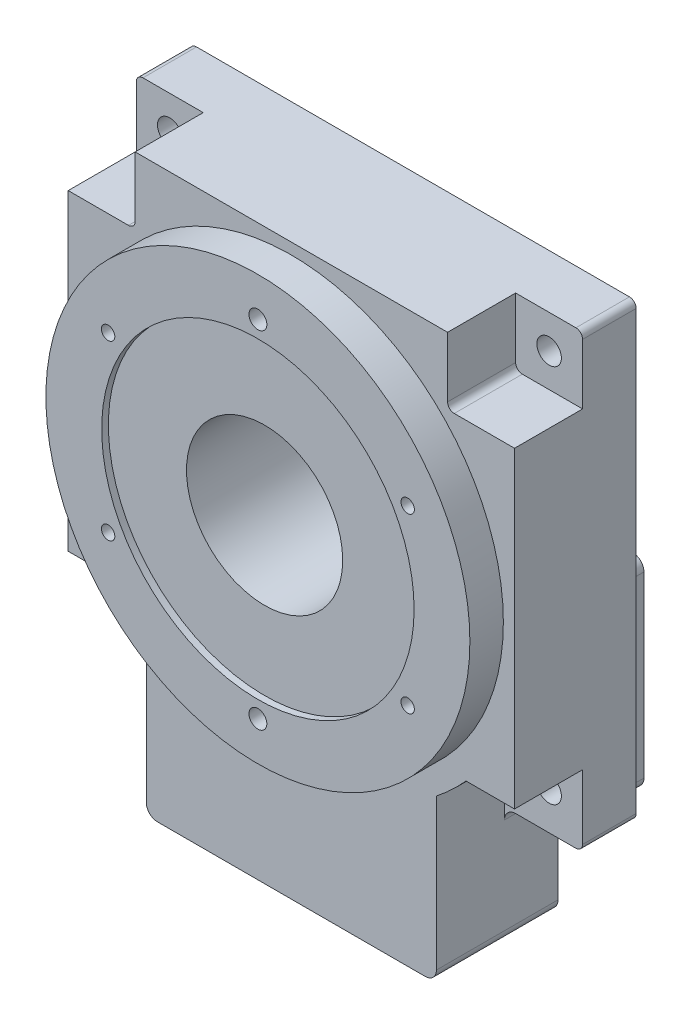
from build123d import *

# Parameters (mm, degrees)
SKETCH_1_R          = 4
SKETCH_1_R_2        = 5.5
SKETCH_1_R_3        = 35
EXTRUDE_1_DEPTH     = 54.5
SKETCH_1_R_4        = 3
EXTRUDE_1_2_DEPTH   = 54.5
EXTRUDE_1_3_DEPTH   = 54.5
SKETCH_1_3_R        = 5.5
EXTRUDE_2_DEPTH     = 24
EXTRUDE_START       = 54.5
SKETCH_1_4_R        = 3
SKETCH_1_4_R_2      = 4
SKETCH_1_4_R_3      = 35
EXTRUDE_3_DEPTH     = 15
CUT_EXTRUDE_START   = 66.5
SKETCH_1_5_R        = 70
SKETCH_1_5_R_2      = 35
CUT_EXTRUDE_1_DEPTH = 3
SKETCH_2_R          = 9.5
SKETCH_2_R_2        = 3
EXTRUDE_4_DEPTH     = 58.5
CUT_EXTRUDE_START_2 = -58.5
SKETCH_2_3_R        = 9.5
CUT_EXTRUDE_2_DEPTH = 41
SKETCH_2_4_R        = 3
CUT_EXTRUDE_3_DEPTH = 15
FILLET_1_R          = 5
SKETCH_3_R          = 25
CUT_EXTRUDE_4_DEPTH = 3
EXTRUDE_5_REACH     = 218.319
CUT_EXTRUDE_START_3 = -30.5
SKETCH_4_3_R        = 5.5
CUT_EXTRUDE_5_DEPTH = 30.5


with BuildPart() as part:
    # 草图1 → 凸台-拉伸1 (new body)
    with BuildSketch(Plane.XY):
        with BuildLine():
            ThreePointArc((-97, 100), (-99.121320344, 99.121320344), (-100, 97))
            Line((-100, 97), (-100, -32.015621187))
            ThreePointArc((-100, -32.015621187), (-86.269705701, -59.854305428), (-65, -82.462112512))
            Line((-65, -82.462112512), (-65, -155))
            Line((-65, -155), (65, -155))
            Line((65, -155), (65, -82.462112512))
            ThreePointArc((65, -82.462112512), (86.269705701, -59.854305428), (100, -32.015621187))
            Line((100, -32.015621187), (100, 97))
            ThreePointArc((100, 97), (99.121320344, 99.121320344), (97, 100))
            Line((97, 100), (-97, 100))
        make_face()
        with BuildLine():
            ThreePointArc((7.75, -102), (7, -102.25), (6.25, -102))
            Line((6.25, -102), (7.75, -102))
        make_face(mode=Mode.SUBTRACT)
        with Locations((0, -77.5)):
            Circle(SKETCH_1_R, mode=Mode.SUBTRACT)
        with Locations((-85, 85)):
            Circle(SKETCH_1_R_2, mode=Mode.SUBTRACT)
        Circle(SKETCH_1_R_3, mode=Mode.SUBTRACT)
        with Locations((0, 77.5)):
            Circle(SKETCH_1_R, mode=Mode.SUBTRACT)
        with Locations((85, 85)):
            Circle(SKETCH_1_R_2, mode=Mode.SUBTRACT)
    extrude(amount=EXTRUDE_1_DEPTH)

    # 草图1<3> → 凸台-拉伸2 (add)
    # profile 1 of 4: a face of its own
    with BuildSketch(Plane.XY):
        with BuildLine():
            ThreePointArc((-97, 100), (-99.121320344, 99.121320344), (-100, 97))
            Line((-100, 97), (-100, 32.015621187))
            ThreePointArc((-100, 32.015621187), (-74.246212025, 74.246212025), (-32.015621187, 100))
            Line((-32.015621187, 100), (-97, 100))
        make_face()
        with Locations((-85, 85)):
            Circle(SKETCH_1_3_R, mode=Mode.SUBTRACT)
    # profile 2 of 4: a face of its own
    with BuildSketch(Plane.XY):
        with BuildLine():
            Line((97, 100), (32.015621187, 100))
            ThreePointArc((32.015621187, 100), (74.246212025, 74.246212025), (100, 32.015621187))
            Line((100, 32.015621187), (100, 97))
            ThreePointArc((100, 97), (99.121320344, 99.121320344), (97, 100))
        make_face()
        with Locations((85, 85)):
            Circle(SKETCH_1_3_R, mode=Mode.SUBTRACT)
    # profile 3 of 4: a face of its own
    with BuildSketch(Plane.XY):
        with BuildLine():
            ThreePointArc((-65, -82.462112512), (-86.269705701, -59.854305428), (-100, -32.015621187))
            Line((-100, -32.015621187), (-100, -99))
            ThreePointArc((-100, -99), (-99.121320344, -101.121320344), (-97, -102))
            Line((-97, -102), (-65, -102))
            Line((-65, -102), (-65, -82.462112512))
        make_face()
        with Locations((-85, -85)):
            Circle(SKETCH_1_3_R, mode=Mode.SUBTRACT)
    # profile 4 of 4: a face of its own
    with BuildSketch(Plane.XY):
        with BuildLine():
            Line((100, -99), (100, -32.015621187))
            ThreePointArc((100, -32.015621187), (86.269705701, -59.854305428), (65, -82.462112512))
            Line((65, -82.462112512), (65, -102))
            Line((65, -102), (97, -102))
            ThreePointArc((97, -102), (99.121320344, -101.121320344), (100, -99))
        make_face()
        with Locations((85, -85)):
            Circle(SKETCH_1_3_R, mode=Mode.SUBTRACT)
    extrude(amount=EXTRUDE_2_DEPTH)

    # 草图1<4> → 凸台-拉伸3 (add)
    with BuildSketch(Plane.XY.offset(EXTRUDE_START)):
        with BuildLine():
            ThreePointArc((-65, -69.282032303), (0, -95), (65, -69.282032303))
            ThreePointArc((65, -69.282032303), (0, 95), (-65, -69.282032303))
        make_face()
        with Locations((-67.116968793, -38.75)):
            Circle(SKETCH_1_4_R, mode=Mode.SUBTRACT)
        with Locations((0, -77.5)):
            Circle(SKETCH_1_4_R_2, mode=Mode.SUBTRACT)
        with Locations((67.116968793, -38.75)):
            Circle(SKETCH_1_4_R, mode=Mode.SUBTRACT)
        with Locations((-67.116968793, 38.75)):
            Circle(SKETCH_1_4_R, mode=Mode.SUBTRACT)
        with Locations((0, 77.5)):
            Circle(SKETCH_1_4_R_2, mode=Mode.SUBTRACT)
        with Locations((67.116968793, 38.75)):
            Circle(SKETCH_1_4_R, mode=Mode.SUBTRACT)
        Circle(SKETCH_1_4_R_3, mode=Mode.SUBTRACT)
    extrude(amount=EXTRUDE_3_DEPTH)

    # 草图1<5> → 切除-拉伸1 (cut)
    with BuildSketch(Plane.XY.offset(CUT_EXTRUDE_START)):
        Circle(SKETCH_1_5_R)
        Circle(SKETCH_1_5_R_2, mode=Mode.SUBTRACT)
    extrude(amount=CUT_EXTRUDE_1_DEPTH, mode=Mode.SUBTRACT)

    # 草图2 → 凸台-拉伸4 (add)
    # profile 1 of 6: a face of its own
    with BuildSketch(Plane.XY):
        with BuildLine():
            ThreePointArc((40, -57), (43.535533906, -58.464466094), (45, -62))
            Line((45, -62), (45, -142))
            ThreePointArc((45, -142), (43.535533906, -145.535533906), (40, -147))
            Line((40, -147), (-40, -147))
            ThreePointArc((-40, -147), (-43.535533906, -145.535533906), (-45, -142))
            Line((-45, -142), (-45, -62))
            ThreePointArc((-45, -62), (-43.535533906, -58.464466094), (-40, -57))
            Line((-40, -57), (40, -57))
        make_face()
        with Locations((0, -102)):
            Circle(SKETCH_2_R, mode=Mode.SUBTRACT)
        with Locations((-34.789653634, -136.789653634)):
            Circle(SKETCH_2_R_2, mode=Mode.SUBTRACT)
        with Locations((34.789653634, -136.789653634)):
            Circle(SKETCH_2_R_2, mode=Mode.SUBTRACT)
        with Locations((34.789653634, -67.210346366)):
            Circle(SKETCH_2_R_2, mode=Mode.SUBTRACT)
        with Locations((-34.789653634, -67.210346366)):
            Circle(SKETCH_2_R_2, mode=Mode.SUBTRACT)
    # profile 2 of 6: a face of its own
    with BuildSketch(Plane.XY):
        with Locations((0, -102)):
            Circle(SKETCH_2_R)
    # profile 3 of 6: a face of its own
    with BuildSketch(Plane.XY):
        with Locations((34.789653634, -67.210346366)):
            Circle(SKETCH_2_R_2)
    # profile 4 of 6: a face of its own
    with BuildSketch(Plane.XY):
        with Locations((-34.789653634, -67.210346366)):
            Circle(SKETCH_2_R_2)
    # profile 5 of 6: a face of its own
    with BuildSketch(Plane.XY):
        with Locations((-34.789653634, -136.789653634)):
            Circle(SKETCH_2_R_2)
    # profile 6 of 6: a face of its own
    with BuildSketch(Plane.XY):
        with Locations((34.789653634, -136.789653634)):
            Circle(SKETCH_2_R_2)
    extrude(amount=-EXTRUDE_4_DEPTH)

    # 草图2<3> → 切除-拉伸2 (cut)
    with BuildSketch(Plane.XY.offset(CUT_EXTRUDE_START_2)):
        with Locations((0, -102)):
            Circle(SKETCH_2_3_R)
    extrude(amount=CUT_EXTRUDE_2_DEPTH, mode=Mode.SUBTRACT)

    # 草图2<4> → 切除-拉伸3 (cut)
    with BuildSketch(Plane.XY.offset(CUT_EXTRUDE_START_2)):
        with Locations((34.789653634, -67.210346366)):
            Circle(SKETCH_2_4_R)
        with Locations((-34.789653634, -67.210346366)):
            Circle(SKETCH_2_4_R)
        with Locations((34.789653634, -136.789653634)):
            Circle(SKETCH_2_4_R)
        with Locations((-34.789653634, -136.789653634)):
            Circle(SKETCH_2_4_R)
    extrude(amount=CUT_EXTRUDE_3_DEPTH, mode=Mode.SUBTRACT)

    # 圆角1
    fillet_1_edges = [part.edges().sort_by_distance(p)[0] for p in [
        (65, -102, 12),
        (-65, -155, 27.25),
        (65, -155, 27.25),
        (-65, -102, 12),
    ]]
    fillet(fillet_1_edges, radius=FILLET_1_R)

    # 草图3 → 切除-拉伸4 (cut)
    with BuildSketch(Plane(origin=(0, 0, -58.5), x_dir=(-1, 0, 0), z_dir=(0, 0, -1))):
        with Locations((0, -102)):
            Circle(SKETCH_3_R)
    extrude(amount=-CUT_EXTRUDE_4_DEPTH, mode=Mode.SUBTRACT)

    # 草图4 → 凸台-拉伸5 (add, up to next)
    with BuildSketch(Plane.XY.offset(54.5), mode=Mode.PRIVATE) as extrude_5_sk1:
        with BuildLine():
            Line((-100, -32.015621187), (-100, -70))
            Line((-100, -70), (-78.262379212, -70))
            ThreePointArc((-78.262379212, -70), (-91.132168958, -52.152926868), (-100, -32.015621187))
        make_face()
    extrude_5_tool1 = extrude(extrude_5_sk1.sketch, amount=-EXTRUDE_5_REACH, mode=Mode.PRIVATE) - part.part
    # 草图4 → 凸台-拉伸5 (add, up to next)
    with BuildSketch(Plane.XY.offset(54.5), mode=Mode.PRIVATE) as extrude_5_sk2:
        with BuildLine():
            ThreePointArc((100, -32.015621187), (91.132168958, -52.152926868), (78.262379212, -70))
            Line((78.262379212, -70), (100, -70))
            Line((100, -70), (100, -32.015621187))
        make_face()
    extrude_5_tool2 = extrude(extrude_5_sk2.sketch, amount=-EXTRUDE_5_REACH, mode=Mode.PRIVATE) - part.part
    add(extrude_5_tool1.solids().sort_by_distance((-93.304828, -58.484573, 54.5))[0])
    add(extrude_5_tool2.solids().sort_by_distance((93.304828, -58.484573, 54.5))[0])

    # 草图4<3> → 切除-拉伸5 (cut)
    # profile 1 of 2: a face of its own
    with BuildSketch(Plane.XY.offset(54.5).offset(CUT_EXTRUDE_START_3)):
        with BuildLine():
            Line((-100, 70), (-73, 70))
            ThreePointArc((-73, 70), (-70.878679656, 70.878679656), (-70, 73))
            Line((-70, 73), (-70, 100))
            Line((-70, 100), (-97, 100))
            ThreePointArc((-97, 100), (-99.121320344, 99.121320344), (-100, 97))
            Line((-100, 97), (-100, 70))
        make_face()
        with Locations((-85, 85)):
            Circle(SKETCH_4_3_R, mode=Mode.SUBTRACT)
    # profile 2 of 2: a face of its own
    with BuildSketch(Plane.XY.offset(54.5).offset(CUT_EXTRUDE_START_3)):
        with BuildLine():
            Line((97, 100), (70, 100))
            Line((70, 100), (70, 73))
            ThreePointArc((70, 73), (70.878679656, 70.878679656), (73, 70))
            Line((73, 70), (100, 70))
            Line((100, 70), (100, 97))
            ThreePointArc((100, 97), (99.121320344, 99.121320344), (97, 100))
        make_face()
        with Locations((85, 85)):
            Circle(SKETCH_4_3_R, mode=Mode.SUBTRACT)
    extrude(amount=CUT_EXTRUDE_5_DEPTH, mode=Mode.SUBTRACT)


with BuildPart() as body_2:
    # 草图1 → Extrude 1 2 (new body)
    with BuildSketch(Plane.XY):
        with Locations((0, 77.5)):
            Circle(SKETCH_1_R_4)
    extrude(amount=EXTRUDE_1_2_DEPTH)


with BuildPart() as body_3:
    # 草图1 → Extrude 1 3 (new body)
    with BuildSketch(Plane.XY):
        with Locations((0, -77.5)):
            Circle(SKETCH_1_R_4)
    extrude(amount=EXTRUDE_1_3_DEPTH)


solid = Compound([part.part, body_2.part, body_3.part])
